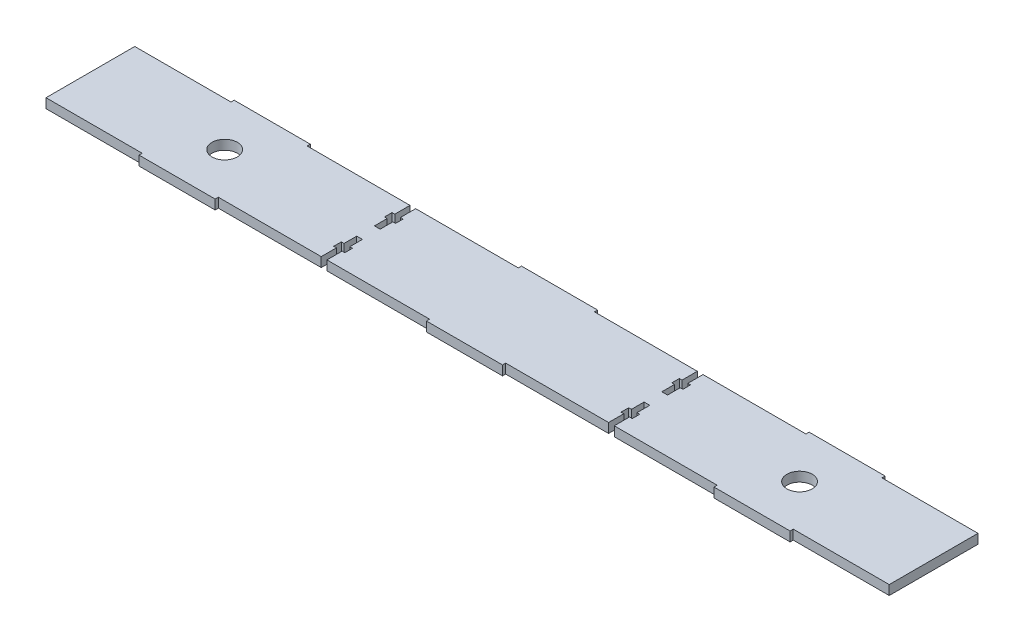
from build123d import *

# Parameters (mm, degrees)
SKETCH1_W           = 428.625
SKETCH1_H           = 47.625
BOSS_EXTRUDE1_DEPTH = 4.7625
SKETCH2_W           = 51.2445
SKETCH2_H           = 1.5875
SKETCH2_W_2         = 51.3715
CUT_EXTRUDE4_DEPTH  = 4.7625
SKETCH4_W           = 3.175
SKETCH4_H           = 44.45
CUT_EXTRUDE5_DEPTH  = 4.7625
SKETCH3_R           = 6.35
CUT_EXTRUDE6_DEPTH  = 4.7625


with BuildPart() as part:
    # Sketch1 → Boss-Extrude1 (new body)
    with BuildSketch(Plane(origin=(0, 0, 0), x_dir=(1, 0, 0), z_dir=(0, 1, 0))):
        Rectangle(SKETCH1_W, SKETCH1_H)
    extrude(amount=BOSS_EXTRUDE1_DEPTH)

    # Sketch2 → Cut-Extrude4 (cut)
    with BuildSketch(Plane.XZ):
        Polygon((-124.841, -22.225), (-124.841, -23.8125), (-19.05, -23.8125), (-19.05, -22.225), (-70.45325, -22.225), (-73.31075, -22.225), align=None)
        with Locations((188.69025, 23.01875)):
            Rectangle(SKETCH2_W, SKETCH2_H)
        Polygon((19.05, 23.8125), (19.05, 22.225), (70.58025, 22.225), (73.43775, 22.225), (124.968, 22.225), (124.968, 23.8125), align=None)
        Polygon((-124.841, 22.225), (-73.31075, 22.225), (-70.45325, 22.225), (-19.05, 22.225), (-19.05, 23.8125), (-124.841, 23.8125), align=None)
        Polygon((19.05, -22.225), (19.05, -23.8125), (124.968, -23.8125), (124.968, -22.225), (73.43775, -22.225), (70.58025, -22.225), align=None)
        with Locations((188.69025, -23.01875)):
            Rectangle(SKETCH2_W, SKETCH2_H)
        with Locations((-188.62675, 23.01875)):
            Rectangle(SKETCH2_W_2, SKETCH2_H)
        with Locations((-188.62675, -23.01875)):
            Rectangle(SKETCH2_W_2, SKETCH2_H)
        Polygon((-70.45325, -4.445), (-70.45325, -10.795), (-69.088, -10.795), (-69.088, -14.605), (-70.45325, -14.605), (-70.45325, -22.225), (-73.31075, -22.225), (-73.31075, -14.605), (-74.676, -14.605), (-74.676, -10.795), (-73.31075, -10.795), (-73.31075, -4.445), align=None)
        Polygon((-70.45325, 4.445), (-73.31075, 4.445), (-73.31075, 10.795), (-74.676, 10.795), (-74.676, 14.605), (-73.31075, 14.605), (-73.31075, 22.225), (-70.45325, 22.225), (-70.45325, 14.605), (-69.088, 14.605), (-69.088, 10.795), (-70.45325, 10.795), align=None)
        Polygon((73.43775, 4.445), (70.58025, 4.445), (70.58025, 10.795), (69.215, 10.795), (69.215, 14.605), (70.58025, 14.605), (70.58025, 22.225), (73.43775, 22.225), (73.43775, 14.605), (74.803, 14.605), (74.803, 10.795), (73.43775, 10.795), align=None)
        Polygon((73.43775, -4.445), (73.43775, -10.795), (74.803, -10.795), (74.803, -14.605), (73.43775, -14.605), (73.43775, -22.225), (70.58025, -22.225), (70.58025, -14.605), (69.215, -14.605), (69.215, -10.795), (70.58025, -10.795), (70.58025, -4.445), align=None)
    extrude(amount=-CUT_EXTRUDE4_DEPTH, mode=Mode.SUBTRACT)

    # Sketch4 → Cut-Extrude5 (cut)
    with BuildSketch(Plane.XZ):
        with Locations((-212.725, 0)):
            Rectangle(SKETCH4_W, SKETCH4_H)
        with Locations((212.725, 0)):
            Rectangle(SKETCH4_W, SKETCH4_H)
    extrude(amount=-CUT_EXTRUDE5_DEPTH, mode=Mode.SUBTRACT)

    # Sketch3 → Cut-Extrude6 (cut)
    with BuildSketch(Plane.XZ):
        with Locations(Location((-143.891, 0, 0), (0, 0, 270))):
            Circle(SKETCH3_R)
        with Locations(Location((144.018, 0, 0), (0, 0, 270))):
            Circle(SKETCH3_R)
    extrude(amount=-CUT_EXTRUDE6_DEPTH, mode=Mode.SUBTRACT)


solid = part.part
